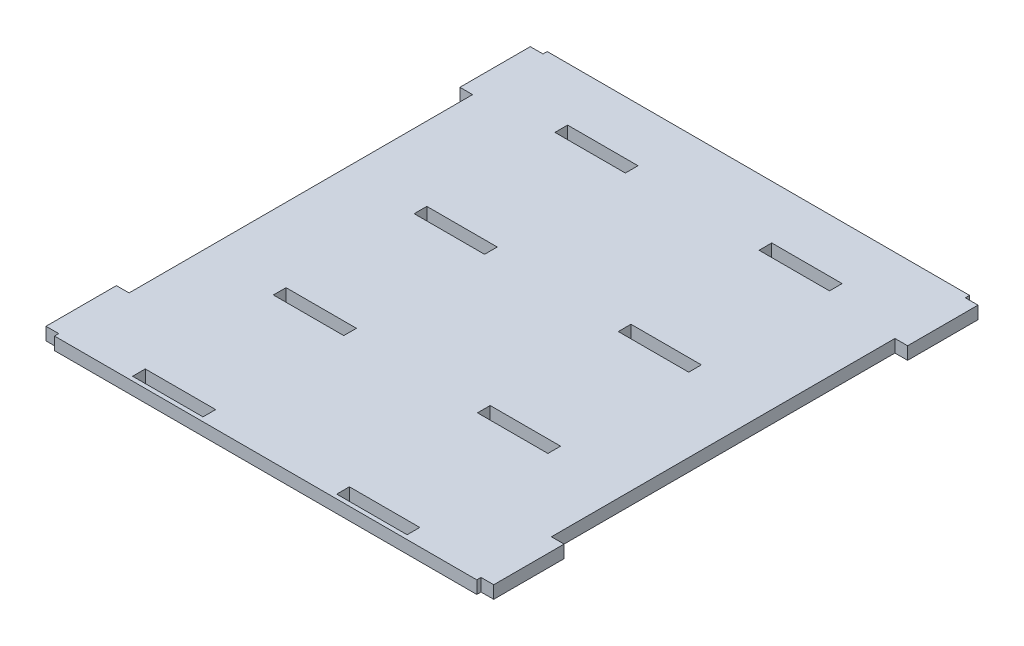
from build123d import *

# Parameters (mm, degrees)
SKETCH1_W           = 100
SKETCH1_H           = 18
BOSS_EXTRUDE1_DEPTH = 18


with BuildPart() as part:
    # Sketch1 → Boss-Extrude1 (new body)
    with BuildSketch(Plane(origin=(0, 0, 0), x_dir=(1, 0, 0), z_dir=(0, 1, 0))):
        Polygon((-300, -7.111898923), (300, -7.111898923), (300, -13.111898923), (318, -13.111898923), (318, -113.111898923), (300, -113.111898923), (300, -601.111898923), (318, -601.111898923), (318, -701.111898923), (300, -701.111898923), (300, -707.111898923), (-300, -707.111898923), (-300, -701.111898923), (-318, -701.111898923), (-318, -601.111898923), (-300, -601.111898923), (-300, -113.111898923), (-318, -113.111898923), (-318, -13.111898923), (-300, -13.111898923), align=None)
        with Locations((-145, -692.111898923)):
            Rectangle(SKETCH1_W, SKETCH1_H, mode=Mode.SUBTRACT)
        with Locations((145, -692.111898923)):
            Rectangle(SKETCH1_W, SKETCH1_H, mode=Mode.SUBTRACT)
        with Locations((145, -492.111898923)):
            Rectangle(SKETCH1_W, SKETCH1_H, mode=Mode.SUBTRACT)
        with Locations((-145, -492.111898923)):
            Rectangle(SKETCH1_W, SKETCH1_H, mode=Mode.SUBTRACT)
        with Locations((145, -292.111898923)):
            Rectangle(SKETCH1_W, SKETCH1_H, mode=Mode.SUBTRACT)
        with Locations((-145, -292.111898923)):
            Rectangle(SKETCH1_W, SKETCH1_H, mode=Mode.SUBTRACT)
        with Locations((145, -92.111898923)):
            Rectangle(SKETCH1_W, SKETCH1_H, mode=Mode.SUBTRACT)
        with Locations((-145, -92.111898923)):
            Rectangle(SKETCH1_W, SKETCH1_H, mode=Mode.SUBTRACT)
    extrude(amount=BOSS_EXTRUDE1_DEPTH)


solid = part.part
